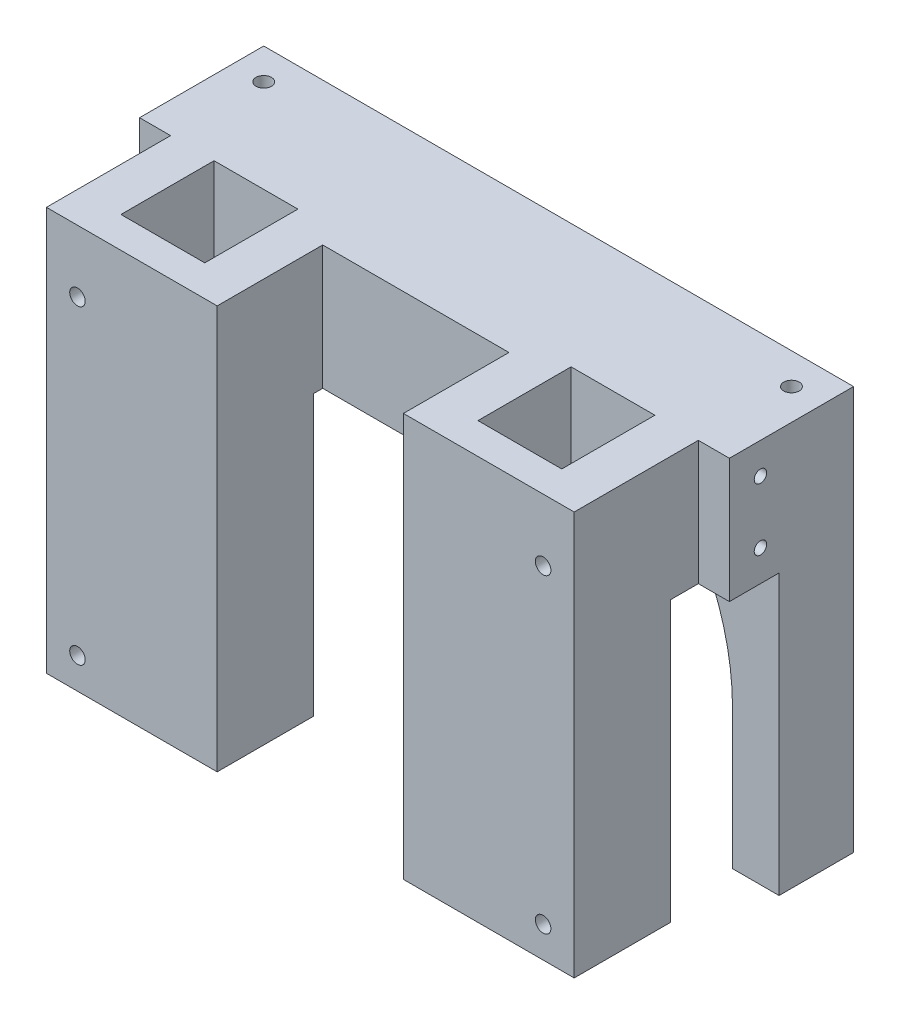
from build123d import *

# Parameters (mm, degrees)
ESQUISSE1_W              = 95
ESQUISSE1_H              = 65
BOSS_EXTRU_1_DEPTH       = 40
ESQUISSE3_R              = 40
ENL_V_MAT_EXTRU_1_DEPTH  = 12
ESQUISSE5_W              = 5
ESQUISSE5_H              = 20
ENL_V_MAT_EXTRU_2_DEPTH  = 90.895772982
ESQUISSE6_W              = 5
ESQUISSE6_H              = 20
ENL_V_MAT_EXTRU_3_DEPTH  = 90.895772982
ESQUISSE7_W              = 80
ESQUISSE7_H              = 22.5
ENL_V_MAT_EXTRU_4_DEPTH  = 12
ESQUISSE8_W              = 95
ESQUISSE8_H              = 12.5
ENL_V_MAT_EXTRU_5_DEPTH  = 45
ESQUISSE10_W             = 30
ESQUISSE10_H             = 65
ENL_V_MAT_EXTRU_6_DEPTH  = 17
ESQUISSE11_W             = 13.5
ESQUISSE11_H             = 15
ENL_V_MAT_EXTRU_7_DEPTH  = 90.895772982
ESQUISSE12_W             = 13.5
ESQUISSE12_H             = 15
ENL_V_MAT_EXTRU_8_DEPTH  = 90.895772982
ESQUISSE14_R             = 1
ENL_V_MAT_EXTRU_9_DEPTH  = 109.079831606
ESQUISSE15_R             = 1.25
ENL_V_MAT_EXTRU_10_DEPTH = 71.089228844
ESQUISSE16_R             = 1.25
ENL_V_MAT_EXTRU_11_DEPTH = 90.895772982


with BuildPart() as part:
    # Esquisse1 → Boss.-Extru.1 (new body)
    with BuildSketch(Plane.XY):
        Rectangle(ESQUISSE1_W, ESQUISSE1_H)
    extrude(amount=BOSS_EXTRU_1_DEPTH)

    # Esquisse3 → Enlèv. mat.-Extru.1 (cut)
    with BuildSketch(Plane(origin=(0, 0, 0), x_dir=(-1, 0, 0), z_dir=(0, 0, -1))):
        with Locations((0, -10)):
            Circle(ESQUISSE3_R)
    extrude(amount=-ENL_V_MAT_EXTRU_1_DEPTH, mode=Mode.SUBTRACT)

    # Esquisse5 → Enlèv. mat.-Extru.2 (cut, through all)
    with BuildSketch(Plane(origin=(0, 32.5, 0), x_dir=(1, 0, 0), z_dir=(0, 1, 0))):
        with Locations((-45, -30)):
            Rectangle(ESQUISSE5_W, ESQUISSE5_H)
    extrude(amount=-ENL_V_MAT_EXTRU_2_DEPTH, mode=Mode.SUBTRACT)

    # Esquisse6 → Enlèv. mat.-Extru.3 (cut, through all)
    with BuildSketch(Plane(origin=(0, 32.5, 0), x_dir=(1, 0, 0), z_dir=(0, 1, 0))):
        with Locations((45, -30)):
            Rectangle(ESQUISSE6_W, ESQUISSE6_H)
    extrude(amount=-ENL_V_MAT_EXTRU_3_DEPTH, mode=Mode.SUBTRACT)

    # Esquisse7 → Enlèv. mat.-Extru.4 (cut)
    with BuildSketch(Plane(origin=(0, 0, 0), x_dir=(-1, 0, 0), z_dir=(0, 0, -1))):
        with Locations((0, -21.25)):
            Rectangle(ESQUISSE7_W, ESQUISSE7_H)
    extrude(amount=-ENL_V_MAT_EXTRU_4_DEPTH, mode=Mode.SUBTRACT)

    # Esquisse8 → Enlèv. mat.-Extru.5 (cut)
    with BuildSketch(Plane.XZ.offset(32.5)):
        with Locations((0, 18.25)):
            Rectangle(ESQUISSE8_W, ESQUISSE8_H)
    extrude(amount=-ENL_V_MAT_EXTRU_5_DEPTH, mode=Mode.SUBTRACT)

    # Esquisse10 → Enlèv. mat.-Extru.6 (cut)
    with BuildSketch(Plane.XY.offset(40)):
        Rectangle(ESQUISSE10_W, ESQUISSE10_H)
    extrude(amount=-ENL_V_MAT_EXTRU_6_DEPTH, mode=Mode.SUBTRACT)

    # Esquisse11 → Enlèv. mat.-Extru.7 (cut, through all)
    with BuildSketch(Plane(origin=(0, 32.5, 0), x_dir=(1, 0, 0), z_dir=(0, 1, 0))):
        with Locations((-28.75, -27.5)):
            Rectangle(ESQUISSE11_W, ESQUISSE11_H)
    extrude(amount=-ENL_V_MAT_EXTRU_7_DEPTH, mode=Mode.SUBTRACT)

    # Esquisse12 → Enlèv. mat.-Extru.8 (cut, through all)
    with BuildSketch(Plane(origin=(0, 32.5, 0), x_dir=(1, 0, 0), z_dir=(0, 1, 0))):
        with Locations((28.75, -27.5)):
            Rectangle(ESQUISSE12_W, ESQUISSE12_H)
    extrude(amount=-ENL_V_MAT_EXTRU_8_DEPTH, mode=Mode.SUBTRACT)

    # Esquisse14 → Enlèv. mat.-Extru.9 (cut, through all)
    with BuildSketch(Plane.ZY.offset(47.5)):
        with Locations((15, 27.5)):
            Circle(ESQUISSE14_R)
        with Locations((15, 17.5)):
            Circle(ESQUISSE14_R)
    extrude(amount=-ENL_V_MAT_EXTRU_9_DEPTH, mode=Mode.SUBTRACT)

    # Esquisse15 → Enlèv. mat.-Extru.10 (cut, through all)
    with BuildSketch(Plane.XY.offset(40)):
        with Locations((-37.5, 22.5)):
            Circle(ESQUISSE15_R)
        with Locations((37.5, 22.5)):
            Circle(ESQUISSE15_R)
        with Locations((-37.5, -27.5)):
            Circle(ESQUISSE15_R)
        with Locations((37.5, -27.5)):
            Circle(ESQUISSE15_R)
    extrude(amount=-ENL_V_MAT_EXTRU_10_DEPTH, mode=Mode.SUBTRACT)

    # Esquisse16 → Enlèv. mat.-Extru.11 (cut, through all)
    with BuildSketch(Plane.XZ.offset(32.5)):
        with Locations(Location((42.5, 5, 0), (0, 0, 270))):
            Circle(ESQUISSE16_R)
        with Locations(Location((-42.5, 5, 0), (0, 0, 270))):
            Circle(ESQUISSE16_R)
    extrude(amount=-ENL_V_MAT_EXTRU_11_DEPTH, mode=Mode.SUBTRACT)


solid = part.part
